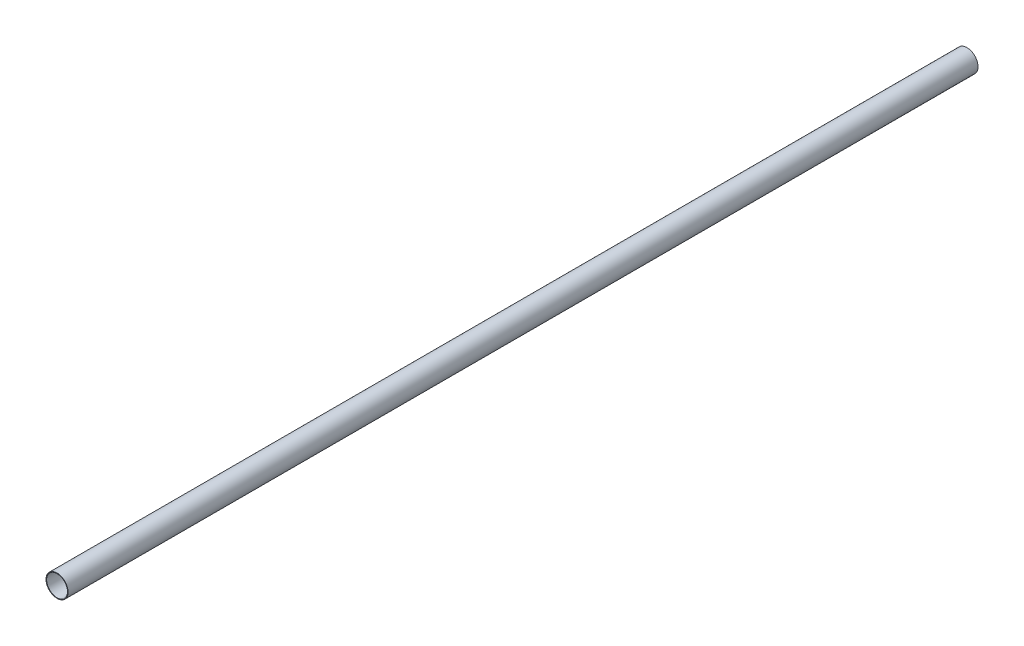
from build123d import *

# Parameters (mm, degrees)
SKETCH1_R           = 11.25
SKETCH1_R_2         = 10.65
BOSS_EXTRUDE1_DEPTH = 927.5


with BuildPart() as part:
    # Sketch1 → Boss-Extrude1 (new body)
    with BuildSketch(Plane.XY):
        with Locations(Location((0, 0, 0), (0, 0, 180))):
            Circle(SKETCH1_R)
        with Locations(Location((0, 0, 0), (0, 0, 180))):
            Circle(SKETCH1_R_2, mode=Mode.SUBTRACT)
    extrude(amount=BOSS_EXTRUDE1_DEPTH)


solid = part.part
